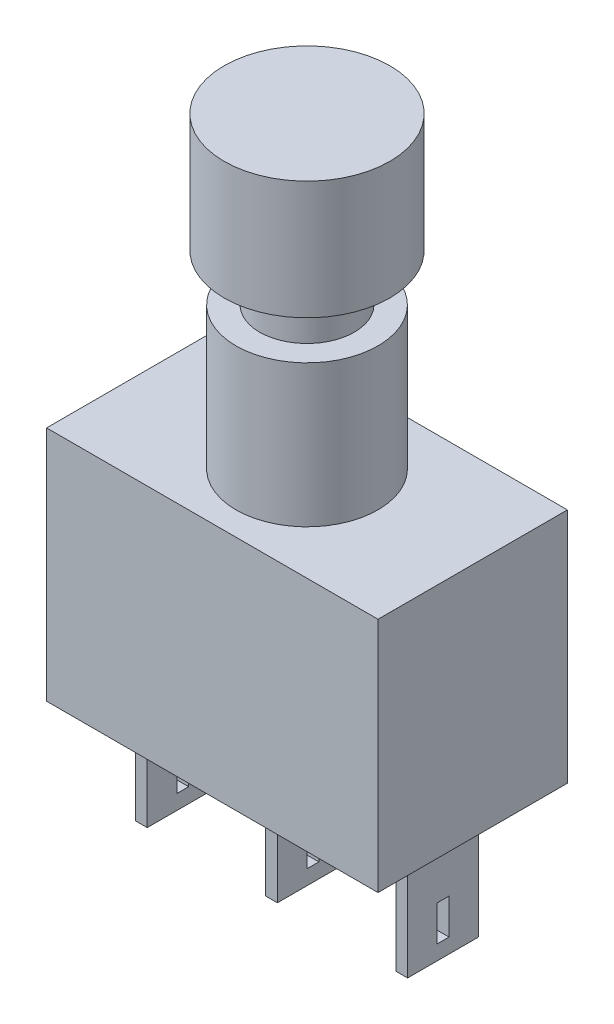
from build123d import *

# Parameters (mm, degrees)
SKETCH2_W          = 14
SKETCH2_H          = 8
EXTRUDE1_DEPTH     = 10
SKETCH3_R          = 3
EXTRUDE2_DEPTH     = 6
SKETCH4_R          = 2
EXTRUDE3_DEPTH     = 2
SKETCH5_R          = 3.5
EXTRUDE4_DEPTH     = 5
SKETCH6_W          = 0.5
SKETCH6_H          = 3
EXTRUDE5_DEPTH     = 5
SKETCH7_W          = 0.5
SKETCH7_H          = 3
EXTRUDE6_DEPTH     = 5
SKETCH8_W          = 0.5
SKETCH8_H          = 3
EXTRUDE7_DEPTH     = 5
SKETCH9_W          = 0.5
SKETCH9_H          = 1.5
CUT_EXTRUDE1_DEPTH = 27.600046992


with BuildPart() as part:
    # Sketch2 → Extrude1 (new body)
    with BuildSketch(Plane(origin=(0, 0, 0), x_dir=(1, 0, 0), z_dir=(0, 1, 0))):
        Rectangle(SKETCH2_W, SKETCH2_H)
    extrude(amount=EXTRUDE1_DEPTH)

    # Sketch3 → Extrude2 (add)
    with BuildSketch(Plane(origin=(0, 10, 0), x_dir=(-1, 0, 0), z_dir=(0, 1, 0))):
        with Locations(Location((0, 0, 0), (0, 0, 90))):
            Circle(SKETCH3_R)
    extrude(amount=EXTRUDE2_DEPTH)

    # Sketch4 → Extrude3 (add)
    with BuildSketch(Plane(origin=(0, 16, 0), x_dir=(-1, 0, 0), z_dir=(0, 1, 0))):
        with Locations(Location((0, 0, 0), (0, 0, 90))):
            Circle(SKETCH4_R)
    extrude(amount=EXTRUDE3_DEPTH)

    # Sketch5 → Extrude4 (add)
    with BuildSketch(Plane(origin=(0, 18, 0), x_dir=(-1, 0, 0), z_dir=(0, 1, 0))):
        with Locations(Location((0, 0, 0), (0, 0, 90))):
            Circle(SKETCH5_R)
    extrude(amount=EXTRUDE4_DEPTH)

    # Sketch6 → Extrude5 (add)
    with BuildSketch(Plane.XZ):
        Rectangle(SKETCH6_W, SKETCH6_H)
    extrude(amount=EXTRUDE5_DEPTH)

    # Sketch7 → Extrude6 (add)
    with BuildSketch(Plane.XZ):
        with Locations((5.5, 0)):
            Rectangle(SKETCH7_W, SKETCH7_H)
    extrude(amount=EXTRUDE6_DEPTH)

    # Sketch8 → Extrude7 (add)
    with BuildSketch(Plane.XZ):
        with Locations((-5.5, 0)):
            Rectangle(SKETCH8_W, SKETCH8_H)
    extrude(amount=EXTRUDE7_DEPTH)

    # Sketch9 → Cut-Extrude1 (cut, through all)
    with BuildSketch(Plane.ZY.offset(5.75)):
        with Locations((0, -3.626725107)):
            Rectangle(SKETCH9_W, SKETCH9_H)
    extrude(amount=-CUT_EXTRUDE1_DEPTH, mode=Mode.SUBTRACT)


solid = part.part
